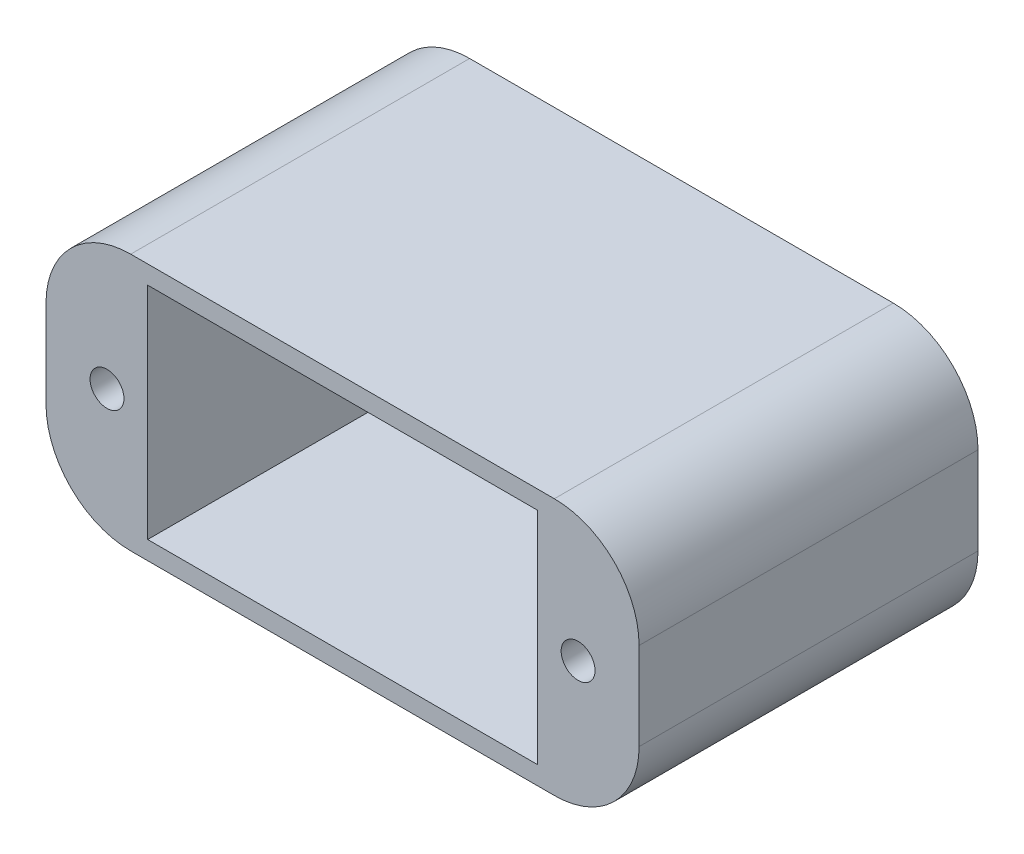
from build123d import *

# Parameters (mm, degrees)
SKETCH1_W           = 35
SKETCH1_H           = 25
BOSS_EXTRUDE1_DEPTH = 10
SKETCH2_W           = 23
SKETCH2_H           = 13
CUT_EXTRUDE1_DEPTH  = 16
CUT_EXTRUDE3_REACH  = 31.368
SKETCH4_W           = 35
SKETCH4_H           = 4.915686931
FILLET2_R           = 5
FILLET3_R           = 5
FILLET4_R           = 5
FILLET5_R           = 5
CUT_EXTRUDE4_REACH  = 29.636
SKETCH3_R           = 1


with BuildPart() as part:
    # Sketch1 → Boss-Extrude1 (new, symmetric)
    with BuildSketch(Plane.XY):
        Rectangle(SKETCH1_W, SKETCH1_H)
    extrude(amount=BOSS_EXTRUDE1_DEPTH, both=True)

    # Sketch2 → Cut-Extrude1 (cut)
    with BuildSketch(Plane.XY.offset(10)):
        Rectangle(SKETCH2_W, SKETCH2_H)
    extrude(amount=-CUT_EXTRUDE1_DEPTH, mode=Mode.SUBTRACT)

    # Sketch4 → Cut-Extrude3 (cut, up to next)
    with BuildSketch(Plane.XY.offset(10), mode=Mode.PRIVATE) as cut_extrude3_sk1:
        with Locations((0, 10.042156535)):
            Rectangle(SKETCH4_W, SKETCH4_H)
    cut_extrude3_tool1 = extrude(cut_extrude3_sk1.sketch, amount=-CUT_EXTRUDE3_REACH, mode=Mode.PRIVATE) & part.part
    # Sketch4 → Cut-Extrude3 (cut, up to next)
    with BuildSketch(Plane.XY.offset(10), mode=Mode.PRIVATE) as cut_extrude3_sk2:
        with Locations((0, -10.042156535)):
            Rectangle(SKETCH4_W, SKETCH4_H)
    cut_extrude3_tool2 = extrude(cut_extrude3_sk2.sketch, amount=-CUT_EXTRUDE3_REACH, mode=Mode.PRIVATE) & part.part
    add(cut_extrude3_tool1.solids().sort_by_distance((0, 10.042157, 10))[0], mode=Mode.SUBTRACT)
    add(cut_extrude3_tool2.solids().sort_by_distance((0, -10.042157, 10))[0], mode=Mode.SUBTRACT)

    # Fillet2
    fillet2_edges = [part.edges().sort_by_distance(p)[0] for p in [
        (17.5, -7.584313069, 0),
    ]]
    fillet(fillet2_edges, radius=FILLET2_R)

    # Fillet3
    fillet3_edges = [part.edges().sort_by_distance(p)[0] for p in [
        (17.5, 7.584313069, 0),
    ]]
    fillet(fillet3_edges, radius=FILLET3_R)

    # Fillet4
    fillet4_edges = [part.edges().sort_by_distance(p)[0] for p in [
        (-17.5, 7.584313069, 0),
    ]]
    fillet(fillet4_edges, radius=FILLET4_R)

    # Fillet5
    fillet5_edges = [part.edges().sort_by_distance(p)[0] for p in [
        (-17.5, -7.584313069, 0),
    ]]
    fillet(fillet5_edges, radius=FILLET5_R)

    # Sketch3 → Cut-Extrude4 (cut, up to next)
    with BuildSketch(Plane.XY.offset(10), mode=Mode.PRIVATE) as cut_extrude4_sk1:
        with Locations((-13.9, 0)):
            Circle(SKETCH3_R)
    cut_extrude4_tool1 = extrude(cut_extrude4_sk1.sketch, amount=-CUT_EXTRUDE4_REACH, mode=Mode.PRIVATE) & part.part
    # Sketch3 → Cut-Extrude4 (cut, up to next)
    with BuildSketch(Plane.XY.offset(10), mode=Mode.PRIVATE) as cut_extrude4_sk2:
        with Locations(Location((13.9, 0, 0), (0, 0, 180))):
            Circle(SKETCH3_R)
    cut_extrude4_tool2 = extrude(cut_extrude4_sk2.sketch, amount=-CUT_EXTRUDE4_REACH, mode=Mode.PRIVATE) & part.part
    add(cut_extrude4_tool1.solids().sort_by_distance((-13.9, 0, 10))[0], mode=Mode.SUBTRACT)
    add(cut_extrude4_tool2.solids().sort_by_distance((13.9, 0, 10))[0], mode=Mode.SUBTRACT)


solid = part.part
